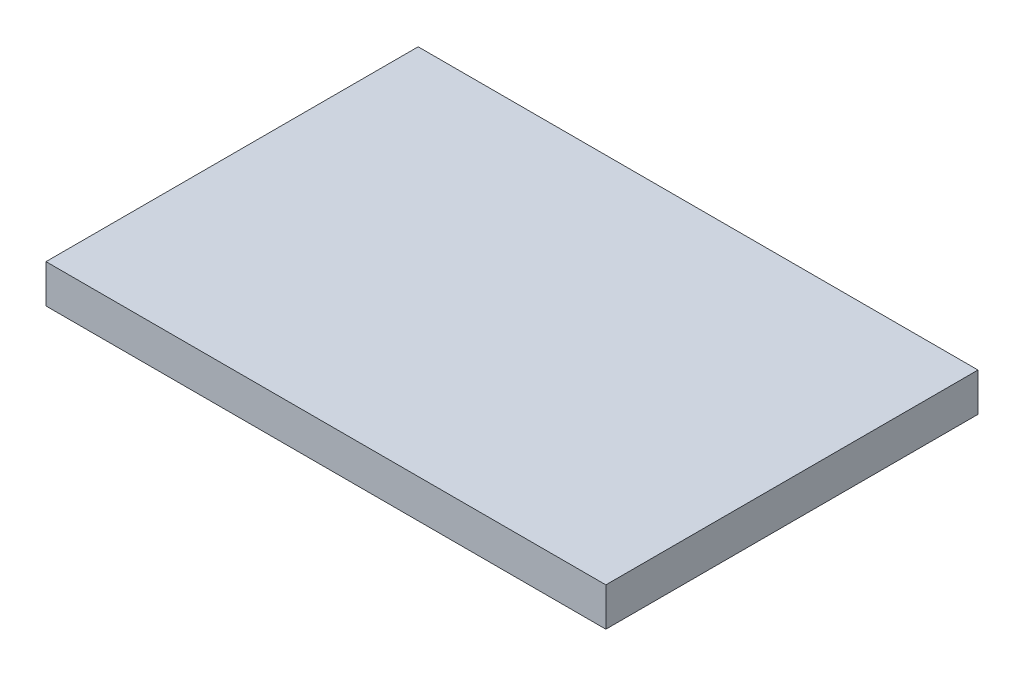
from build123d import *

# Parameters (mm, degrees)
SKETCH1_W           = 51
SKETCH1_H           = 33.9
BOSS_EXTRUDE1_DEPTH = 3.5


with BuildPart() as part:
    # Sketch1 → Boss-Extrude1 (new body)
    with BuildSketch(Plane(origin=(0, 0, 0), x_dir=(1, 0, 0), z_dir=(0, 1, 0))):
        Rectangle(SKETCH1_W, SKETCH1_H)
    extrude(amount=BOSS_EXTRUDE1_DEPTH)


solid = part.part
